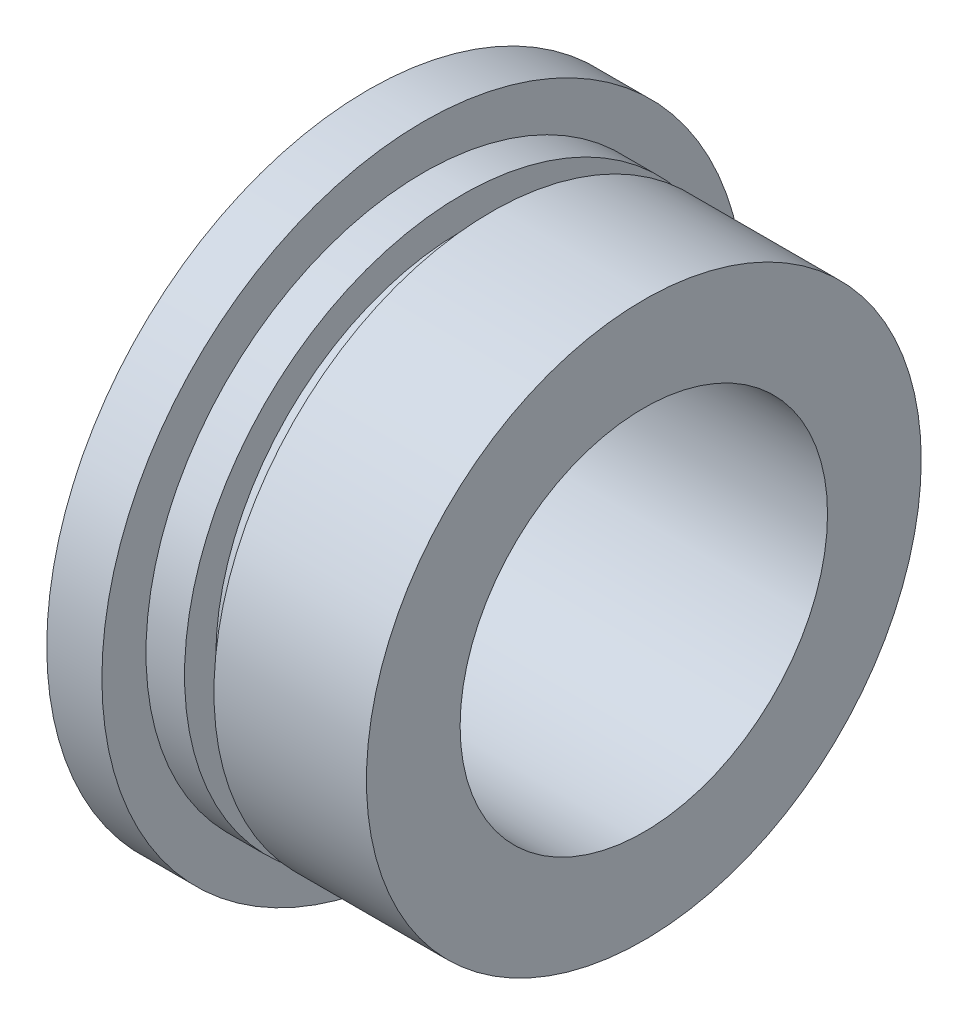
from build123d import *


with BuildPart() as part:
    # Sketch1 → Revolve1 (revolve)
    with BuildSketch(Plane.XY, mode=Mode.PRIVATE) as revolve1_sk:
        Polygon((-37.979362121, 37.085201662), (-40.979362121, 37.085201662), (-40.979362121, 44.585201662), (-25.979362121, 44.585201662), (-25.979362121, 39.485201662), (-34.279362121, 39.485201662), (-34.279362121, 41.185201662), (-35.879362121, 41.185201662), (-35.879362121, 39.485201662), (-37.979362121, 39.485201662), align=None)
    revolve(revolve1_sk.sketch.rotate(Axis((-23.644882831, 54.585201662, 0), (-1, 0, 0)), 270), axis=Axis((-23.644882831, 54.585201662, 0), (-1, 0, 0)))


solid = part.part
